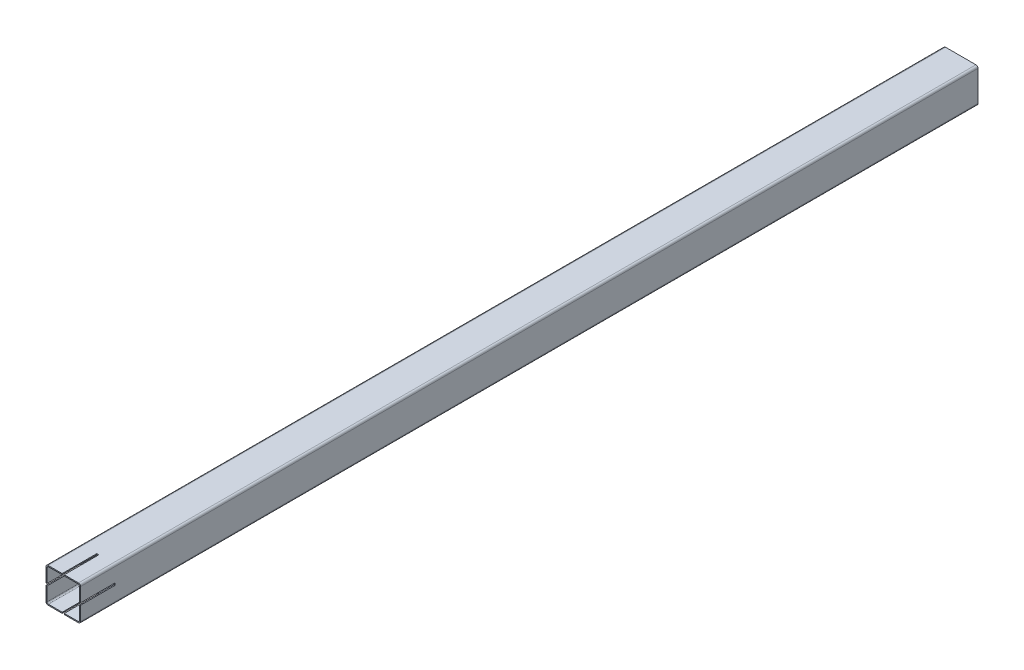
from build123d import *

# Parameters (mm, degrees)
EXTRUDE_1_DEPTH     = 2600
CUT_EXTRUDE_1_DEPTH = 100


with BuildPart() as part:
    # Эскиз1 → Бобышка-Вытянуть1 (new body)
    with BuildSketch(Plane.XY):
        with BuildLine():
            Line((-44, 50), (44, 50))
            ThreePointArc((44, 50), (48.242640687, 48.242640687), (50, 44))
            Line((50, 44), (50, -44))
            ThreePointArc((50, -44), (48.242640687, -48.242640687), (44, -50))
            Line((44, -50), (-44, -50))
            ThreePointArc((-44, -50), (-48.242640687, -48.242640687), (-50, -44))
            Line((-50, -44), (-50, 44))
            ThreePointArc((-50, 44), (-48.242640687, 48.242640687), (-44, 50))
        make_face()
        with BuildLine():
            Line((-43, 47), (43, 47))
            ThreePointArc((43, 47), (45.828427125, 45.828427125), (47, 43))
            Line((47, 43), (47, -43))
            ThreePointArc((47, -43), (45.828427125, -45.828427125), (43, -47))
            Line((43, -47), (-43, -47))
            ThreePointArc((-43, -47), (-45.828427125, -45.828427125), (-47, -43))
            Line((-47, -43), (-47, 43))
            ThreePointArc((-47, 43), (-45.828427125, 45.828427125), (-43, 47))
        make_face(mode=Mode.SUBTRACT)
    extrude(amount=-EXTRUDE_1_DEPTH)

    # Эскиз2 → Вырез-Вытянуть1 (cut)
    with BuildSketch(Plane.XY):
        Polygon((-50, 3), (-3, 3), (-3, 50), (3, 50), (3, 3), (50, 3), (50, -3), (3, -3), (3, -50), (-3, -50), (-3, -3), (-50, -3), align=None)
    extrude(amount=-CUT_EXTRUDE_1_DEPTH, mode=Mode.SUBTRACT)


solid = part.part
